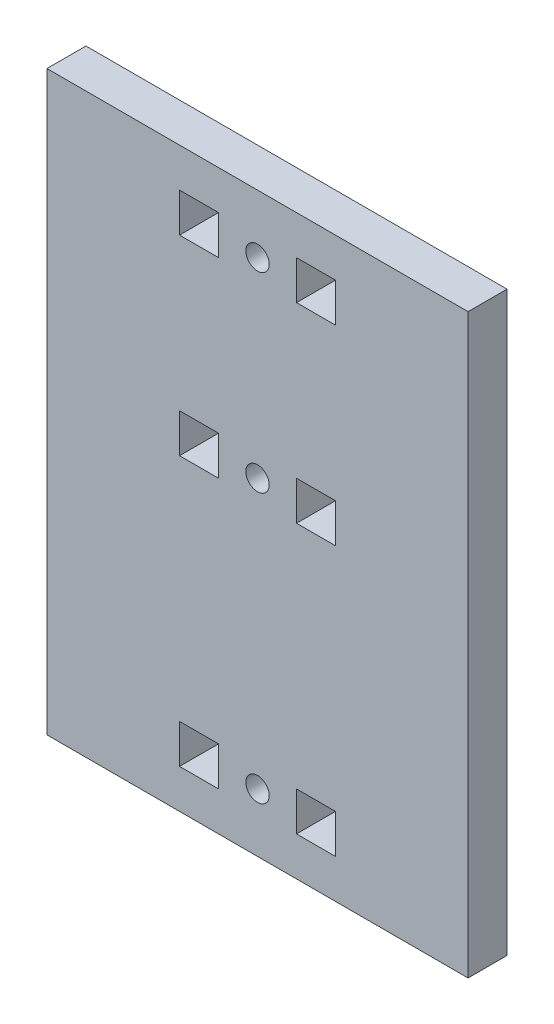
from build123d import *

# Parameters (mm, degrees)
SKETCH1_W           = 54
SKETCH1_H           = 74
SKETCH1_R           = 1.5
SKETCH1_W_2         = 5
SKETCH1_H_2         = 5
BOSS_EXTRUDE1_DEPTH = 5


with BuildPart() as part:
    # Sketch1 → Boss-Extrude1 (new body)
    with BuildSketch(Plane.XY):
        with Locations((0, -5)):
            Rectangle(SKETCH1_W, SKETCH1_H)
        Circle(SKETCH1_R, mode=Mode.SUBTRACT)
        with Locations((0, 24.5)):
            Circle(SKETCH1_R, mode=Mode.SUBTRACT)
        with Locations((0, -34.5)):
            Circle(SKETCH1_R, mode=Mode.SUBTRACT)
        with Locations((-7.5, 0)):
            Rectangle(SKETCH1_W_2, SKETCH1_H_2, mode=Mode.SUBTRACT)
        with Locations((7.5, 0)):
            Rectangle(SKETCH1_W_2, SKETCH1_H_2, mode=Mode.SUBTRACT)
        with Locations((-7.5, 24.5)):
            Rectangle(SKETCH1_W_2, SKETCH1_H_2, mode=Mode.SUBTRACT)
        with Locations((7.5, 24.5)):
            Rectangle(SKETCH1_W_2, SKETCH1_H_2, mode=Mode.SUBTRACT)
        with Locations((-7.5, -34.5)):
            Rectangle(SKETCH1_W_2, SKETCH1_H_2, mode=Mode.SUBTRACT)
        with Locations((7.5, -34.5)):
            Rectangle(SKETCH1_W_2, SKETCH1_H_2, mode=Mode.SUBTRACT)
    extrude(amount=BOSS_EXTRUDE1_DEPTH)


solid = part.part
